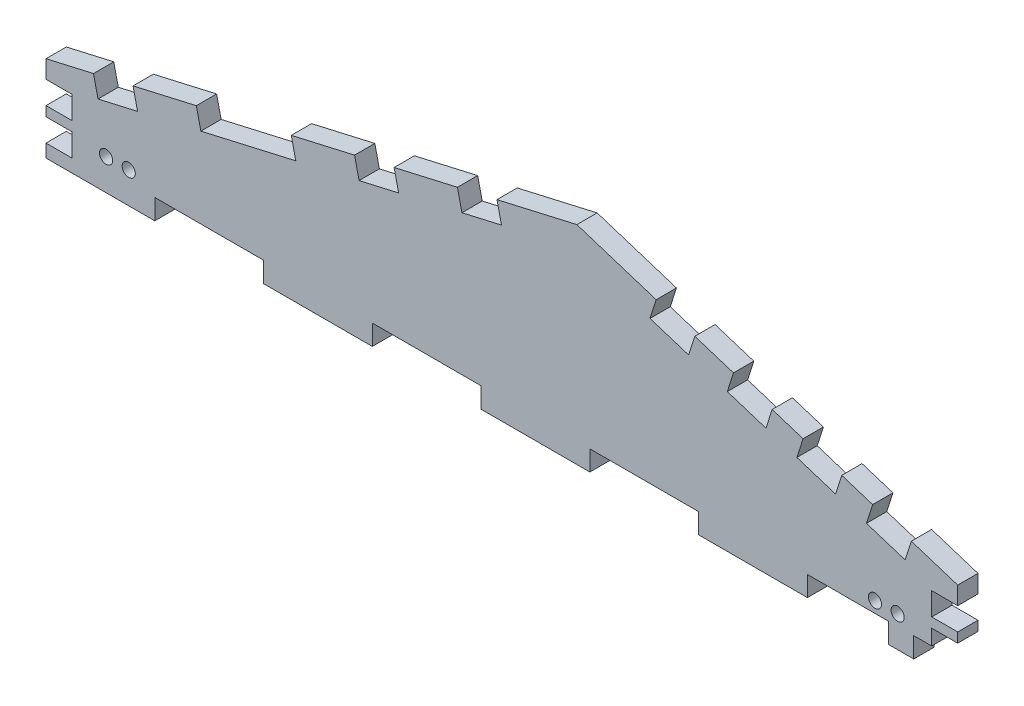
from build123d import *

# Parameters (mm, degrees)
BOSS_EXTRUDE1_DEPTH = 3.175
SKETCH4_W           = 17.018
SKETCH4_H           = 3.175
SKETCH4_H_2         = 3.144138513
SKETCH4_W_2         = 3.937
SKETCH4_W_3         = 12.7
CUT_EXTRUDE1_DEPTH  = 3.175
SKETCH5_W           = 7.516860114
SKETCH5_H           = 3.175
CUT_EXTRUDE2_DEPTH  = 3.175
SKETCH6_R           = 1.0287
CUT_EXTRUDE3_DEPTH  = 3.175
CUT_EXTRUDE4_DEPTH  = 4.064


with BuildPart() as part:
    # Sketch2 → Boss-Extrude1 (new body)
    with BuildSketch(Plane.XY):
        Polygon((-71.3232, 6.731), (11.7348, 6.731), (11.7348, 25.781), align=None)
        Polygon((11.7348, 25.781), (11.7348, 6.731), (71.3232, 6.731), align=None)
        Polygon((11.7348, 6.731), (11.7348, -6.731), (71.3232, -6.731), (71.3232, -4.699), (67.2592, -4.699), (67.2592, -1.143), (71.3232, -1.143), (71.3232, 0.381), (67.2592, 0.381), (67.2592, 3.937), (71.3232, 3.937), (71.3232, 4.572927428), (71.3232, 6.731), align=None)
        Polygon((-71.3232, -6.731), (11.7348, -6.731), (11.7348, 6.731), (-71.3232, 6.731), (-71.3232, 3.937), (-67.2592, 3.937), (-67.2592, 0.381), (-71.3232, 0.381), (-71.3232, -1.143), (-67.2592, -1.143), (-67.2592, -4.699), (-71.3232, -4.699), align=None)
    extrude(amount=BOSS_EXTRUDE1_DEPTH)

    # Sketch4 → Cut-Extrude1 (cut)
    with BuildSketch(Plane.XY.offset(3.175)):
        with Locations((-45.7962, -5.1435)):
            Rectangle(SKETCH4_W, SKETCH4_H)
        with Locations((-11.7602, -5.1435)):
            Rectangle(SKETCH4_W, SKETCH4_H)
        with Locations((22.2758, -5.158930744)):
            Rectangle(SKETCH4_W, SKETCH4_H_2)
        with Locations((75.1713, -5.1435)):
            Rectangle(SKETCH4_W_2, SKETCH4_H)
        with Locations((54.1528, -5.158930744)):
            Rectangle(SKETCH4_W_3, SKETCH4_H_2)
    extrude(amount=-CUT_EXTRUDE1_DEPTH, mode=Mode.SUBTRACT)

    # Sketch5 → Cut-Extrude2 (cut)
    with BuildSketch(Plane.XY.offset(3.175)):
        with Locations((68.198230057, -5.1435)):
            Rectangle(SKETCH5_W, SKETCH5_H)
    extrude(amount=-CUT_EXTRUDE2_DEPTH, mode=Mode.SUBTRACT)

    # Sketch6 → Cut-Extrude3 (cut)
    with BuildSketch(Plane.XY.offset(3.175)):
        with Locations((-61.9252, -1.8542)):
            Circle(SKETCH6_R)
        with Locations((-58.378607788, -1.8542)):
            Circle(SKETCH6_R)
        with Locations(Location((61.9252, -1.8542, 0), (0, 0, 180))):
            Circle(SKETCH6_R)
        with Locations(Location((58.378607788, -1.8542, 0), (0, 0, 180))):
            Circle(SKETCH6_R)
    extrude(amount=-CUT_EXTRUDE3_DEPTH, mode=Mode.SUBTRACT)

    # Sketch7 → Cut-Extrude4 (cut)
    with BuildSketch(Plane.XY.offset(3.175)):
        Polygon((-63.896048939, 8.434475014), (-57.706756389, 9.854037525), (-56.996975133, 6.75939125), (-63.186267684, 5.339828739), align=None)
        Polygon((-47.803888308, 12.125337544), (-32.949586187, 15.532287572), (-32.239804931, 12.437641297), (-47.094107052, 9.030691269), align=None)
        Polygon((-23.046718106, 17.80358759), (-16.857425556, 19.223150102), (-16.1476443, 16.128503827), (-22.33693685, 14.708941315), align=None)
        Polygon((-6.954557475, 21.49445012), (-0.765264924, 22.914012632), (-0.055483668, 19.819366357), (-6.244776219, 18.399803845), align=None)
        Polygon((24.145430883, 21.813407007), (30.193862821, 19.879765083), (29.227041859, 16.855549114), (23.178609921, 18.789191038), align=None)
        Polygon((36.242294759, 17.946123159), (42.290726697, 16.012481235), (41.323905735, 12.988265266), (35.275473797, 14.92190719), align=None)
        Polygon((47.129472248, 14.465567696), (53.177904186, 12.531925772), (52.211083224, 9.507709803), (46.162651286, 11.441351727), align=None)
        Polygon((58.016649736, 10.985012233), (64.065081674, 9.051370309), (63.098260712, 6.02715434), (57.049828774, 7.960796264), align=None)
    extrude(amount=-CUT_EXTRUDE4_DEPTH, mode=Mode.SUBTRACT)


solid = part.part
